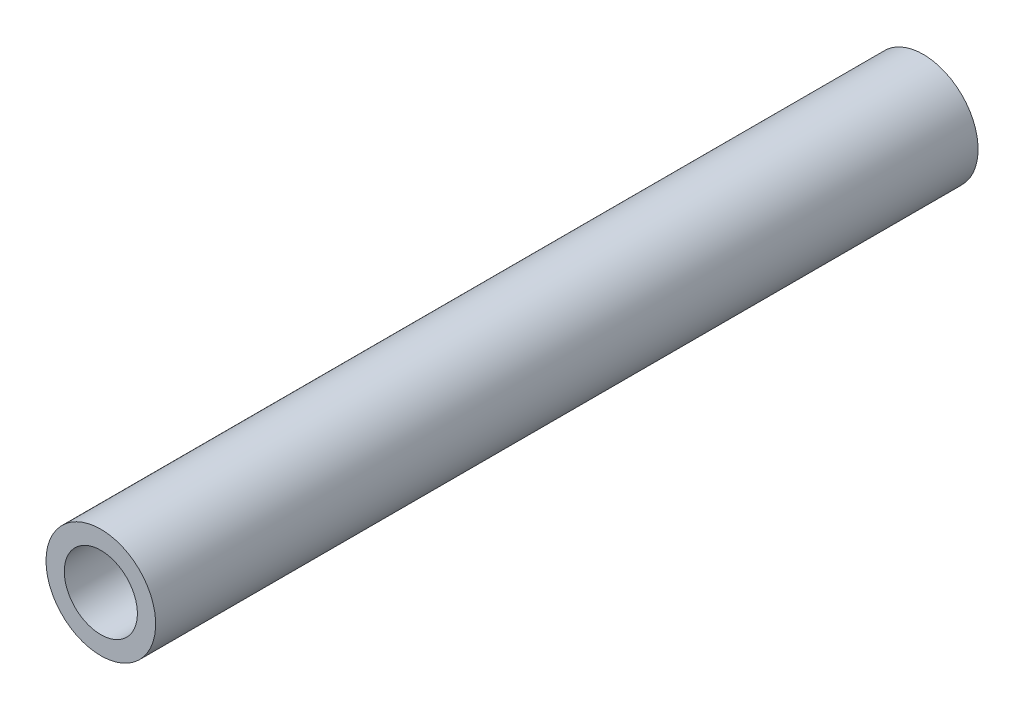
from build123d import *

# Parameters (mm, degrees)
SKETCH_1_R      = 3
SKETCH_1_R_2    = 2
EXTRUDE_1_DEPTH = 22.5


with BuildPart() as part:
    # 草图1 → 凸台-拉伸1 (new, symmetric)
    with BuildSketch(Plane.XY):
        with Locations(Location((0, 0, 0), (0, 0, 180))):
            Circle(SKETCH_1_R)
        with Locations(Location((0, 0, 0), (0, 0, 180))):
            Circle(SKETCH_1_R_2, mode=Mode.SUBTRACT)
    extrude(amount=EXTRUDE_1_DEPTH, both=True)


solid = part.part
